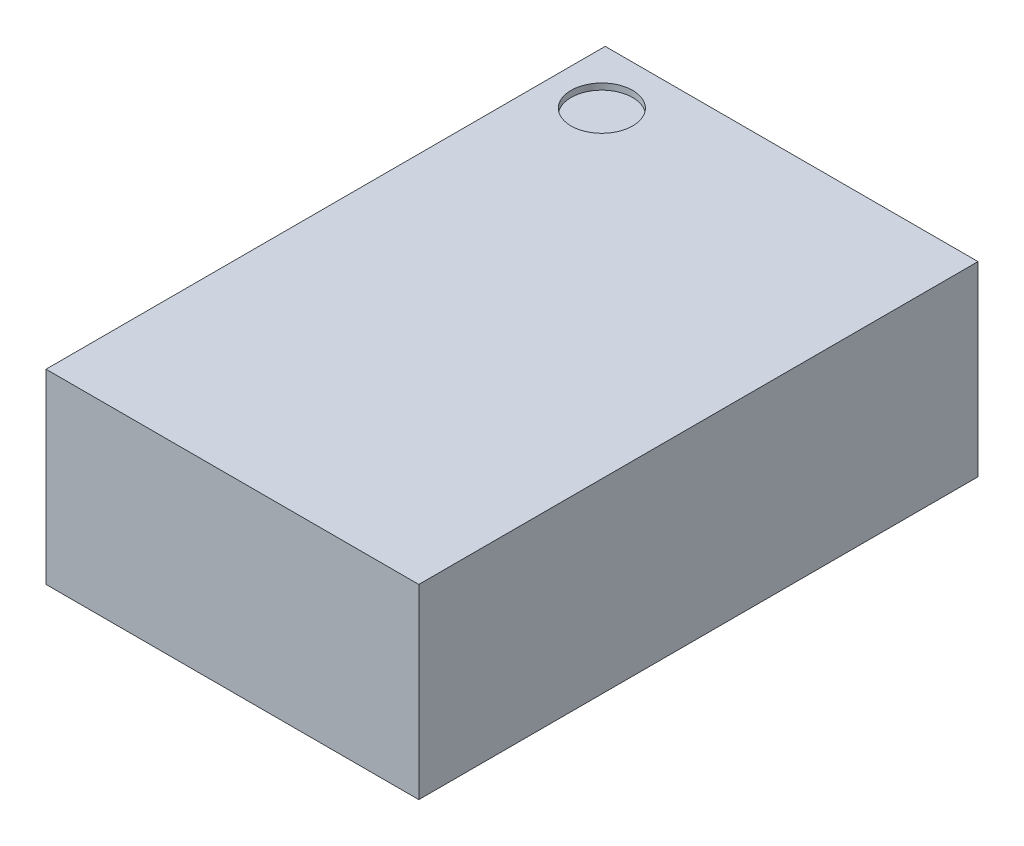
from build123d import *

# Parameters (mm, degrees)
SKETCH1_W           = 1.5
SKETCH1_H           = 2.25
BOSS_EXTRUDE1_DEPTH = 0.75
SKETCH2_R           = 0.124038388
CUT_EXTRUDE1_DEPTH  = 0.025
SKETCH3_W           = 0.5
SKETCH3_H           = 0.7
SKETCH3_W_2         = 0.6
SKETCH3_H_2         = 0.21
BOSS_EXTRUDE2_DEPTH = 0.01


with BuildPart() as part:
    # Sketch1 → Boss-Extrude1 (new body)
    with BuildSketch(Plane(origin=(0, 0, 0), x_dir=(1, 0, 0), z_dir=(0, 1, 0))):
        Rectangle(SKETCH1_W, SKETCH1_H)
    extrude(amount=BOSS_EXTRUDE1_DEPTH)

    # Sketch2 → Cut-Extrude1 (cut)
    with BuildSketch(Plane(origin=(0, 0.75, 0), x_dir=(1, 0, 0), z_dir=(0, 1, 0))):
        with Locations(Location((-0.541377071, 0.902898767, 0), (0, 0, 270))):
            Circle(SKETCH2_R)
    extrude(amount=-CUT_EXTRUDE1_DEPTH, mode=Mode.SUBTRACT)

    # Sketch3 → Boss-Extrude2 (add)
    with BuildSketch(Plane.XZ):
        with Locations((0.4, 0.7)):
            Rectangle(SKETCH3_W, SKETCH3_H)
        with Locations((-0.4, 0.7)):
            Rectangle(SKETCH3_W, SKETCH3_H)
        with Locations((0.41, -0.095)):
            Rectangle(SKETCH3_W_2, SKETCH3_H_2)
        with Locations((-0.41, -0.095)):
            Rectangle(SKETCH3_W_2, SKETCH3_H_2)
        with Locations((0.41, -0.525)):
            Rectangle(SKETCH3_W_2, SKETCH3_H_2)
        with Locations((0.41, -0.955)):
            Rectangle(SKETCH3_W_2, SKETCH3_H_2)
        with Locations((-0.41, -0.525)):
            Rectangle(SKETCH3_W_2, SKETCH3_H_2)
        Polygon((-0.71, -0.85), (-0.71, -1.06), (-0.215, -1.06), (-0.11, -0.928960223), (-0.11, -0.85), align=None)
    extrude(amount=BOSS_EXTRUDE2_DEPTH)


solid = part.part
